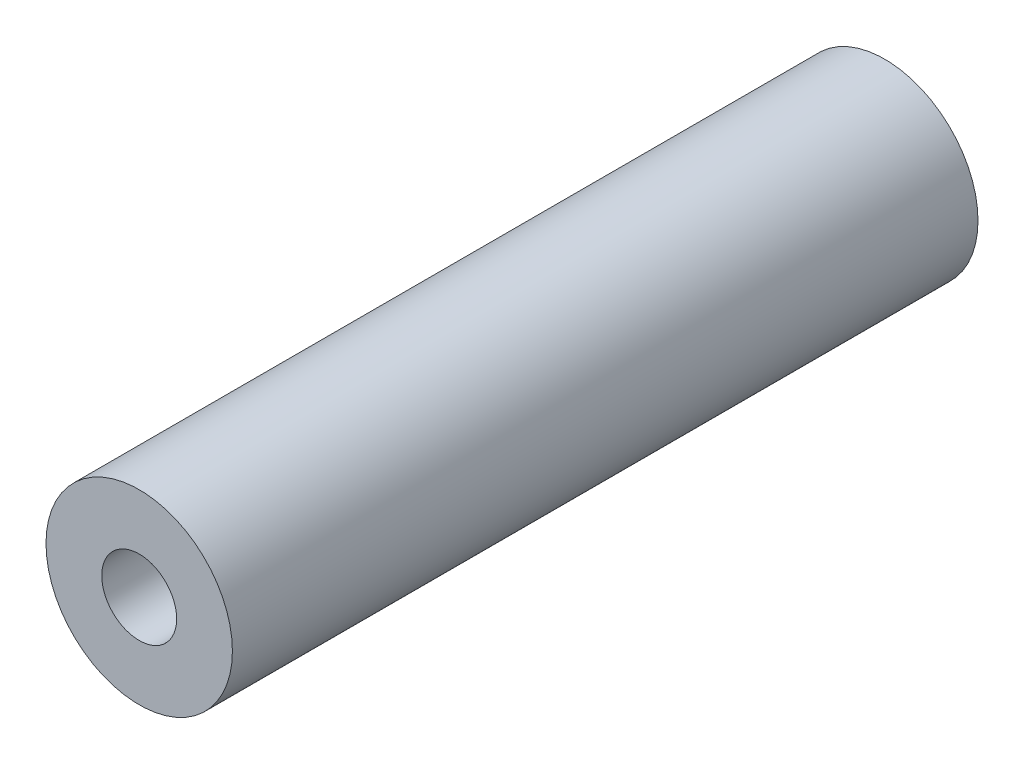
from build123d import *

# Parameters (mm, degrees)
SKETCH1_R           = 6.35
SKETCH1_R_2         = 2.5527
BOSS_EXTRUDE1_DEPTH = 25.4


with BuildPart() as part:
    # Sketch1 → Boss-Extrude1 (new, symmetric)
    with BuildSketch(Plane.XY):
        Circle(SKETCH1_R)
        Circle(SKETCH1_R_2, mode=Mode.SUBTRACT)
    extrude(amount=BOSS_EXTRUDE1_DEPTH, both=True)


solid = part.part
